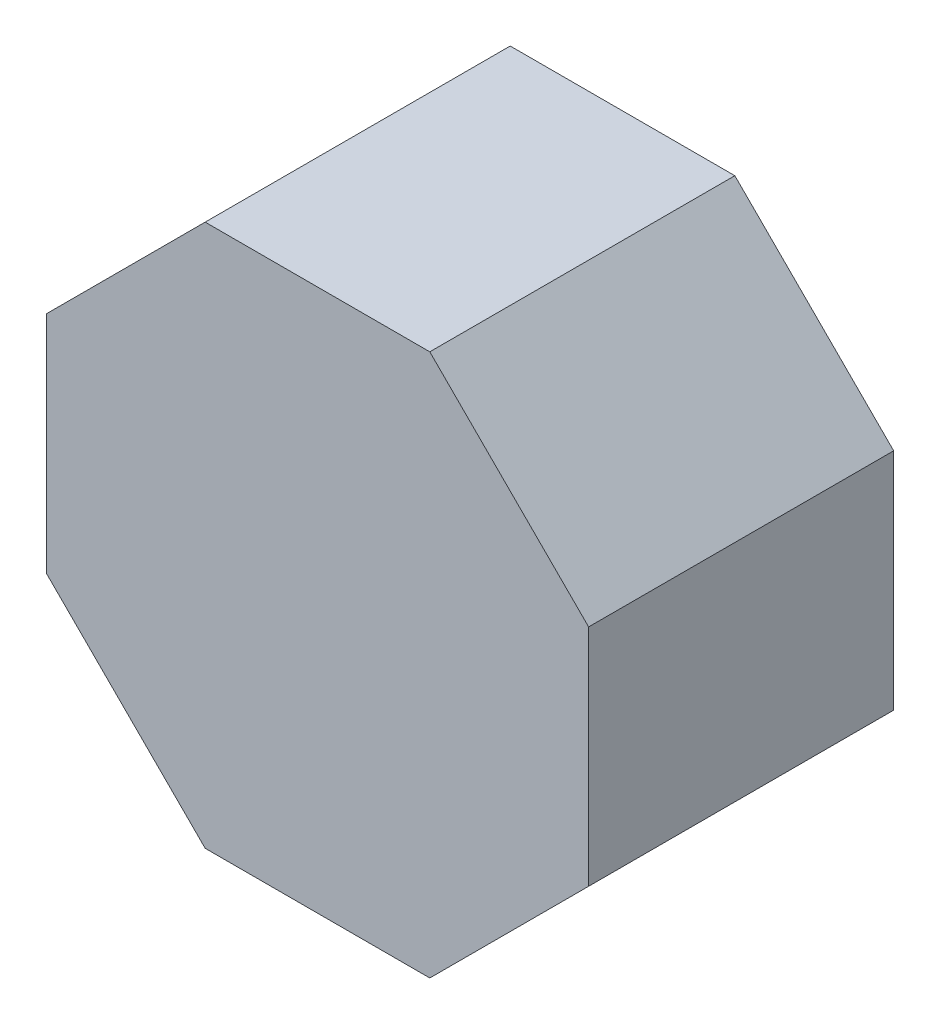
from build123d import *

# Parameters (mm, degrees)
EXTRUDE_1_DEPTH = 4.5


with BuildPart() as part:
    # Эскиз1 → Бобышка-Вытянуть1 (new body)
    with BuildSketch(Plane.XY):
        Polygon((-1.656854249, 4), (1.656854249, 4), (4, 1.656854249), (4, -1.656854249), (1.656854249, -4), (-1.656854249, -4), (-4, -1.656854249), (-4, 1.656854249), align=None)
    extrude(amount=EXTRUDE_1_DEPTH)


solid = part.part
